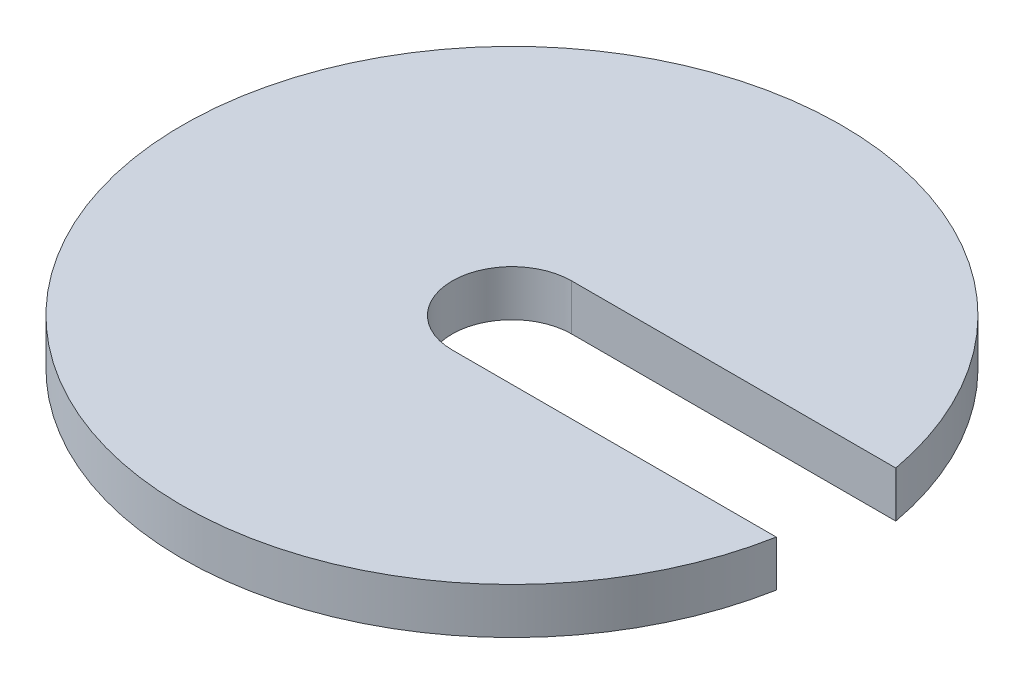
from build123d import *

# Parameters (mm, degrees)
BOSS_EXTRUDE1_DEPTH = 3


with BuildPart() as part:
    # Sketch1 → Boss-Extrude1 (new body)
    with BuildSketch(Plane(origin=(0, 0, 0), x_dir=(1, 0, 0), z_dir=(0, 1, 0))):
        with BuildLine():
            Line((21.125095664, -3.9), (0, -3.9))
            ThreePointArc((0, -3.9), (-3.9, 0), (0, 3.9))
            Line((0, 3.9), (21.125095664, 3.9))
            ThreePointArc((21.125095664, 3.9), (21.134212017, 3.899989345), (21.14332832, 3.899957381))
            ThreePointArc((21.14332832, 3.899957381), (-21.5, 0), (21.14332832, -3.899957381))
            ThreePointArc((21.14332832, -3.899957381), (21.134212017, -3.899989345), (21.125095664, -3.9))
        make_face()
    extrude(amount=BOSS_EXTRUDE1_DEPTH)


solid = part.part
